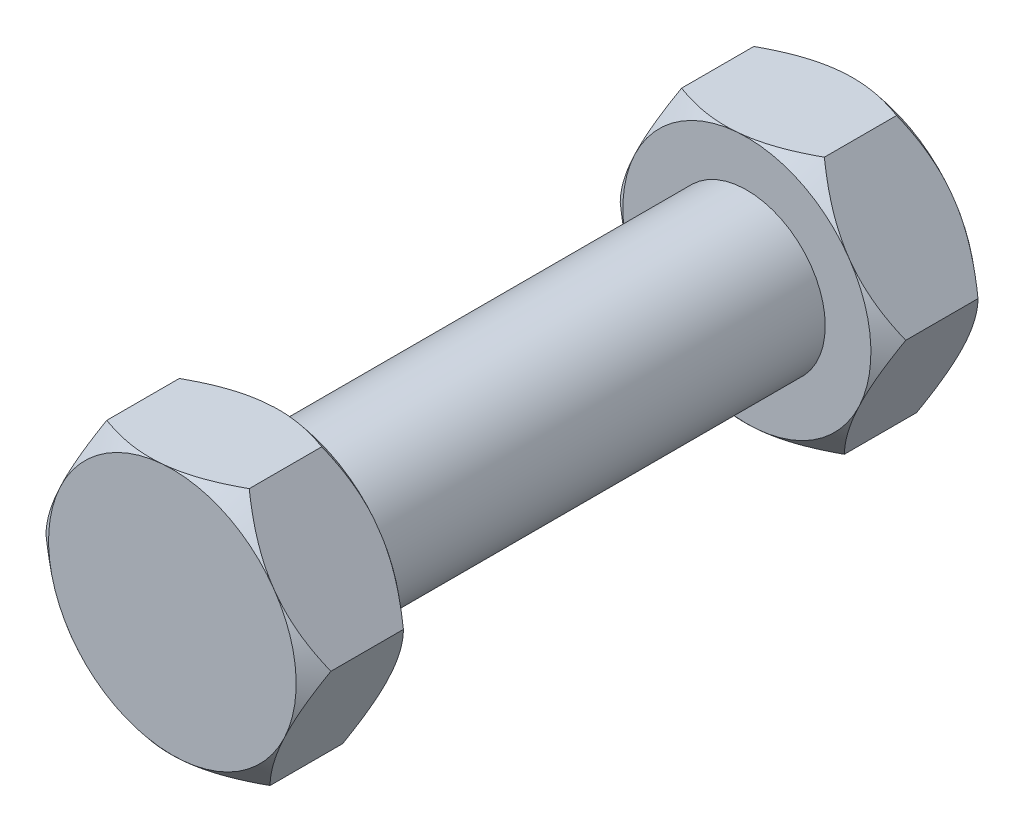
from build123d import *

# Parameters (mm, degrees)
SKETCH1_R           = 6
BOSS_EXTRUDE1_DEPTH = 36
BOSS_EXTRUDE2_DEPTH = 8
SKETCH3_OUTSIDE_W   = 53.532
SKETCH3_OUTSIDE_H   = 51.488
SKETCH3_OUTSIDE_R   = 9.5
CUT_EXTRUDE1_DEPTH  = 8
CUT_EXTRUDE1_DRAFT  = -50
SKETCH4_OUTSIDE_W   = 53.532
SKETCH4_OUTSIDE_H   = 51.488
SKETCH4_OUTSIDE_R   = 9.5
CUT_EXTRUDE3_DEPTH  = 8
CUT_EXTRUDE3_DRAFT  = -50
BOSS_EXTRUDE3_DEPTH = 8
SKETCH6_OUTSIDE_W   = 54.894
SKETCH6_OUTSIDE_H   = 52.85
SKETCH6_OUTSIDE_R   = 9.5
CUT_EXTRUDE6_DEPTH  = 8
CUT_EXTRUDE6_DRAFT  = -50
SKETCH7_OUTSIDE_W   = 54.894
SKETCH7_OUTSIDE_H   = 52.85
SKETCH7_OUTSIDE_R   = 9.481063721
CUT_EXTRUDE7_DEPTH  = 8
CUT_EXTRUDE7_DRAFT  = -50


with BuildPart() as part:
    # Sketch1 → Boss-Extrude1 (new body)
    with BuildSketch(Plane.XY):
        Circle(SKETCH1_R)
    extrude(amount=BOSS_EXTRUDE1_DEPTH)

    # Sketch2 → Boss-Extrude2 (add)
    with BuildSketch(Plane(origin=(0, 0, 0), x_dir=(-1, 0, 0), z_dir=(0, 0, -1))):
        Polygon((-10.93381737, 0.885985919), (-6.234194998, -9.025970644), (4.699622372, -9.911956562), (10.93381737, -0.885985919), (6.234194998, 9.025970644), (-4.699622372, 9.911956562), align=None)
    extrude(amount=BOSS_EXTRUDE2_DEPTH)


with BuildPart() as cut_extrude1_tool:
    # Sketch3 outside → Cut-Extrude1 (with draft: the straight prism first)
    with BuildSketch(Plane.XY):
        Rectangle(SKETCH3_OUTSIDE_W, SKETCH3_OUTSIDE_H)
        Circle(SKETCH3_OUTSIDE_R, mode=Mode.SUBTRACT)
    extrude(amount=-CUT_EXTRUDE1_DEPTH)
    # Cut-Extrude1: the draft: its side faces are tilted about the plane it starts from
    cut_extrude1_sides = [cut_extrude1_tool.faces().sort_by_distance(p)[0] for p in [
        (0, -25.744, -4),
        (26.766, 0, -4),
        (0, 25.744, -4),
        (-26.766, 0, -4),
        (-9.5, 0, -4),
    ]]
    draft(cut_extrude1_sides, Plane.XY, CUT_EXTRUDE1_DRAFT)


with BuildPart() as part_1:
    add(part.part)

    # Cut-Extrude1: cut by cut_extrude1_tool
    add(cut_extrude1_tool.part, mode=Mode.SUBTRACT)


with BuildPart() as cut_extrude3_tool:
    # Sketch4 outside → Cut-Extrude3 (with draft: the straight prism first)
    with BuildSketch(Plane(origin=(0, 0, -8), x_dir=(-1, 0, 0), z_dir=(0, 0, -1))):
        Rectangle(SKETCH4_OUTSIDE_W, SKETCH4_OUTSIDE_H)
        Circle(SKETCH4_OUTSIDE_R, mode=Mode.SUBTRACT)
    extrude(amount=-CUT_EXTRUDE3_DEPTH)
    # Cut-Extrude3: the draft: its side faces are tilted about the plane it starts from
    cut_extrude3_sides = [cut_extrude3_tool.faces().sort_by_distance(p)[0] for p in [
        (0, -25.744, -4),
        (-26.766, 0, -4),
        (0, 25.744, -4),
        (26.766, 0, -4),
        (9.5, 0, -4),
    ]]
    draft(cut_extrude3_sides, Plane(origin=(0, 0, -8), x_dir=(-1, 0, 0), z_dir=(0, 0, -1)), CUT_EXTRUDE3_DRAFT)


with BuildPart() as part_2:
    add(part_1.part)

    # Cut-Extrude3: cut by cut_extrude3_tool
    add(cut_extrude3_tool.part, mode=Mode.SUBTRACT)

    # Sketch5 → Boss-Extrude3 (add)
    with BuildSketch(Plane.XY.offset(36)):
        Polygon((-6.252986911, 8.986336688), (-10.908889314, -0.92207717), (-4.655902404, -9.908413858), (6.252986911, -8.986336688), (10.908889314, 0.92207717), (4.655902404, 9.908413858), align=None)
    extrude(amount=BOSS_EXTRUDE3_DEPTH)


with BuildPart() as cut_extrude6_tool:
    # Sketch6 outside → Cut-Extrude6 (with draft: the straight prism first)
    with BuildSketch(Plane(origin=(0, 0, 36), x_dir=(-1, 0, 0), z_dir=(0, 0, -1))):
        Rectangle(SKETCH6_OUTSIDE_W, SKETCH6_OUTSIDE_H)
        Circle(SKETCH6_OUTSIDE_R, mode=Mode.SUBTRACT)
    extrude(amount=-CUT_EXTRUDE6_DEPTH)
    # Cut-Extrude6: the draft: its side faces are tilted about the plane it starts from
    cut_extrude6_sides = [cut_extrude6_tool.faces().sort_by_distance(p)[0] for p in [
        (0, -26.425, 40),
        (-27.447, 0, 40),
        (0, 26.425, 40),
        (27.447, 0, 40),
        (9.5, 0, 40),
    ]]
    draft(cut_extrude6_sides, Plane(origin=(0, 0, 36), x_dir=(-1, 0, 0), z_dir=(0, 0, -1)), CUT_EXTRUDE6_DRAFT)


with BuildPart() as part_3:
    add(part_2.part)

    # Cut-Extrude6: cut by cut_extrude6_tool
    add(cut_extrude6_tool.part, mode=Mode.SUBTRACT)


with BuildPart() as cut_extrude7_tool:
    # Sketch7 outside → Cut-Extrude7 (with draft: the straight prism first)
    with BuildSketch(Plane.XY.offset(44)):
        Rectangle(SKETCH7_OUTSIDE_W, SKETCH7_OUTSIDE_H)
        Circle(SKETCH7_OUTSIDE_R, mode=Mode.SUBTRACT)
    extrude(amount=-CUT_EXTRUDE7_DEPTH)
    # Cut-Extrude7: the draft: its side faces are tilted about the plane it starts from
    cut_extrude7_sides = [cut_extrude7_tool.faces().sort_by_distance(p)[0] for p in [
        (0, -26.425, 40),
        (27.447, 0, 40),
        (0, 26.425, 40),
        (-27.447, 0, 40),
        (-9.481063721, 0, 40),
    ]]
    draft(cut_extrude7_sides, Plane.XY.offset(44), CUT_EXTRUDE7_DRAFT)


with BuildPart() as part_4:
    add(part_3.part)

    # Cut-Extrude7: cut by cut_extrude7_tool
    add(cut_extrude7_tool.part, mode=Mode.SUBTRACT)


solid = part_4.part
